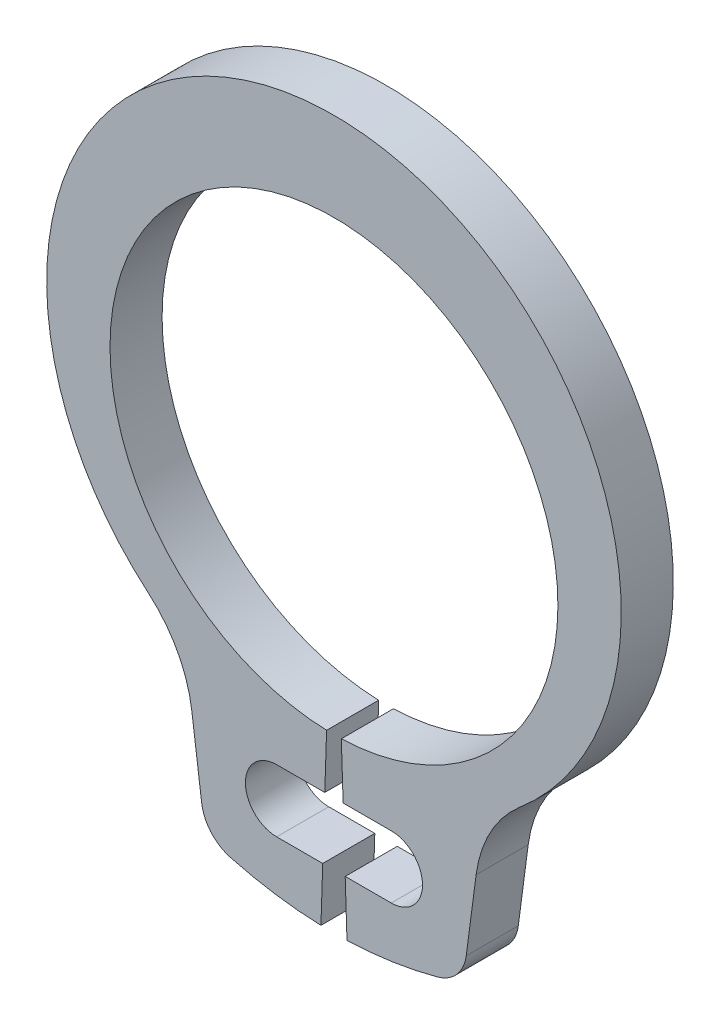
from build123d import *

# Parameters (mm, degrees)
BODYSKE_R   = 0.6
BODY_DEPTH  = 1
NOTSKE_W    = 2.2
NOTSKE_H    = 1.2
NOTCH_DEPTH = 10.440335771


with BuildPart() as part:
    # BodySke → Body (new body)
    with BuildSketch(Plane.XY):
        with BuildLine():
            Line((0.141447368, -4.297672933), (0.25, -7.595887045))
            ThreePointArc((0.25, -7.595887045), (1.128872442, -7.515693382), (1.992522935, -7.334156554))
            ThreePointArc((1.992522935, -7.334156554), (2.360630596, -7.103919978), (2.539476028, -6.708285749))
            Line((2.539476028, -6.708285749), (2.729556329, -5.264482519))
            ThreePointArc((2.729556329, -5.264482519), (3.006670078, -4.413490978), (3.571246669, -3.719061784))
            ThreePointArc((3.571246669, -3.719061784), (0, 6), (-3.571246669, -3.719061784))
            ThreePointArc((-3.571246669, -3.719061784), (-3.006670078, -4.413490978), (-2.729556329, -5.264482519))
            Line((-2.729556329, -5.264482519), (-2.539476028, -6.708285749))
            ThreePointArc((-2.539476028, -6.708285749), (-2.360630596, -7.103919978), (-1.992522935, -7.334156554))
            ThreePointArc((-1.992522935, -7.334156554), (-1.128872442, -7.515693382), (-0.25, -7.595887045))
            Line((-0.25, -7.595887045), (-0.141447368, -4.297672933))
            ThreePointArc((-0.141447368, -4.297672933), (0, 4.3), (0.141447368, -4.297672933))
        make_face()
        with Locations((1.1, -5.949159605)):
            Circle(BODYSKE_R, mode=Mode.SUBTRACT)
        with Locations((-1.1, -5.949159605)):
            Circle(BODYSKE_R, mode=Mode.SUBTRACT)
    extrude(amount=-BODY_DEPTH)

    # NotSke → Notch (cut, through all)
    with BuildSketch(Plane.XY):
        with Locations((0, -5.949159605)):
            Rectangle(NOTSKE_W, NOTSKE_H)
    extrude(amount=-NOTCH_DEPTH, mode=Mode.SUBTRACT)


solid = part.part
